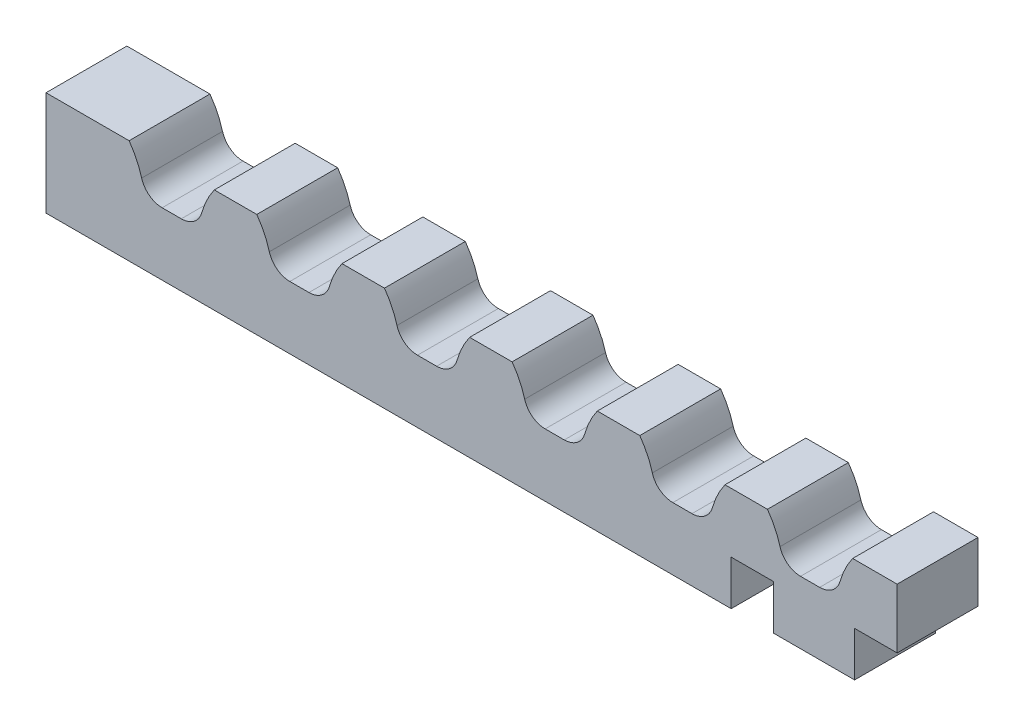
from build123d import *

# Parameters (mm, degrees)
CROQUIS4_W              = 40
CROQUIS4_H              = 4.9
SALIENTE_EXTRUIR1_DEPTH = 3.8
CORTAR_EXTRUIR1_DEPTH   = 5
REDONDEO1_R             = 1
MATRIZL1_COUNT          = 6
MATRIZL1_PITCH          = 6
REDONDEO1_OF_MATRIZL1_R = 1
CROQUIS7_W              = 2
CROQUIS7_H              = 4.2
CORTAR_EXTRUIR2_DEPTH   = 10


with BuildPart() as part:
    # Croquis4 → Saliente-Extruir1 (new body)
    with BuildSketch(Plane.XY):
        Rectangle(CROQUIS4_W, CROQUIS4_H)
    extrude(amount=SALIENTE_EXTRUIR1_DEPTH)

    # Croquis5 → Cortar-Extruir1 (cut)
    with BuildSketch(Plane.XY.offset(3.8)):
        with BuildLine():
            Line((-16.122428878, 2.488752454), (-12.062122986, 2.488752454))
            ThreePointArc((-12.062122986, 2.488752454), (-12.575562017, 1.545062529), (-12.814503922, 0.497648057))
            Line((-12.814503922, 0.497648057), (-15.370047942, 0.497648057))
            ThreePointArc((-15.370047942, 0.497648057), (-15.608989847, 1.545062529), (-16.122428878, 2.488752454))
        make_face()
    cortar_extruir1 = extrude(amount=-CORTAR_EXTRUIR1_DEPTH, mode=Mode.SUBTRACT)

    # Redondeo1
    redondeo1_edges = [part.edges().sort_by_distance(p)[0] for p in [
        (-12.814503922, 0.497648057, 1.9),
        (-15.370047942, 0.497648057, 1.9),
    ]]
    fillet(redondeo1_edges, radius=REDONDEO1_R)

    # MatrizL1: Cortar-Extruir1 ×6
    with Locations(*[(i * MATRIZL1_PITCH, 0, 0) for i in range(1, MATRIZL1_COUNT)]):
        add(cortar_extruir1, mode=Mode.SUBTRACT)

    # Redondeo1 of MatrizL1
    redondeo1_of_matrizl1_edges = [part.edges().sort_by_distance(p)[0] for p in [
        (-6.814503922, 0.497648057, 1.9),
        (-9.370047942, 0.497648057, 1.9),
        (-0.814503922, 0.497648057, 1.9),
        (-3.370047942, 0.497648057, 1.9),
        (5.185496078, 0.497648057, 1.9),
        (2.629952058, 0.497648057, 1.9),
        (11.185496078, 0.497648057, 1.9),
        (8.629952058, 0.497648057, 1.9),
        (17.185496078, 0.497648057, 1.9),
        (14.629952058, 0.497648057, 1.9),
    ]]
    fillet(redondeo1_of_matrizl1_edges, radius=REDONDEO1_OF_MATRIZL1_R)

    # Croquis7 → Cortar-Extruir2 (cut)
    with BuildSketch(Plane.XY.offset(3.8)):
        with Locations((19, -2.45)):
            Rectangle(CROQUIS7_W, CROQUIS7_H)
        with Locations((13.2, -2.45)):
            Rectangle(CROQUIS7_W, CROQUIS7_H)
    extrude(amount=-CORTAR_EXTRUIR2_DEPTH, mode=Mode.SUBTRACT)


solid = part.part
